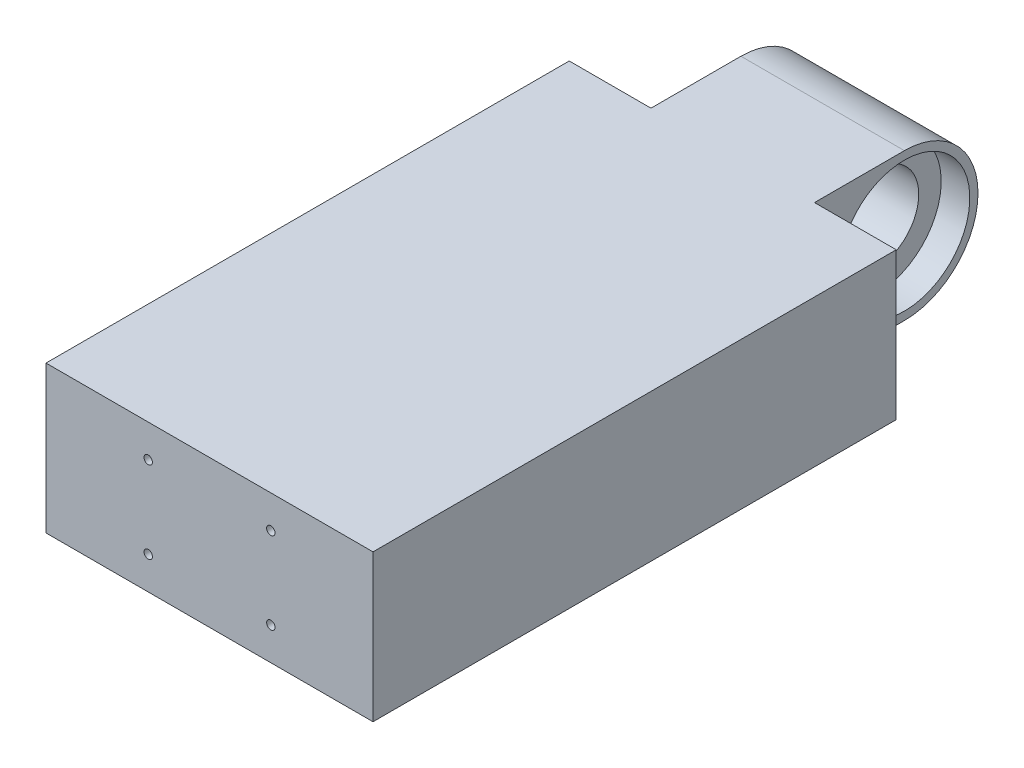
from build123d import *

# Parameters (mm, degrees)
SKETCH1_W               = 80
SKETCH1_H               = 36
BOSS_EXTRUDE1_DEPTH     = 150
M2_5_TAPPED_HOLE1_D     = 2.05
M2_5_TAPPED_HOLE1_DEPTH = 3.35
M2_5_TAPPED_HOLE1_TIP   = 0.615882135
BOSS_EXTRUDE2_DEPTH     = 80
SKETCH7_W               = 20
SKETCH7_H               = 40
CUT_EXTRUDE4_DEPTH      = 80
SKETCH5_R               = 10.5
CUT_EXTRUDE5_DEPTH      = 80
SKETCH8_R               = 16
CUT_EXTRUDE6_DEPTH      = 7


with BuildPart() as part:
    # Sketch1 → Boss-Extrude1 (new body)
    with BuildSketch(Plane.XY):
        with Locations((40, 18)):
            Rectangle(SKETCH1_W, SKETCH1_H)
    extrude(amount=BOSS_EXTRUDE1_DEPTH)

    # M2.5 Tapped Hole1
    with Locations(Plane(origin=(25, 28, 150), x_dir=(1, 0, 0), z_dir=(0, 0, 1))):
        with Locations((0, 0), (30, 0), (30, -20), (0, -20)):
            Hole(M2_5_TAPPED_HOLE1_D / 2, depth=M2_5_TAPPED_HOLE1_DEPTH)
            with Locations((0, 0, -(M2_5_TAPPED_HOLE1_DEPTH + M2_5_TAPPED_HOLE1_TIP / 2))):  # 118° drill point
                Cone(0, M2_5_TAPPED_HOLE1_D / 2, M2_5_TAPPED_HOLE1_TIP, mode=Mode.SUBTRACT)

    # Sketch4 → Boss-Extrude2 (add)
    with BuildSketch(Plane.ZY):
        with BuildLine():
            Line((0, 36), (0, 0))
            ThreePointArc((0, 0), (-18, 18), (0, 36))
        make_face()
    extrude(amount=-BOSS_EXTRUDE2_DEPTH)

    # Sketch7 → Cut-Extrude4 (cut)
    with BuildSketch(Plane(origin=(0, 36, 0), x_dir=(1, 0, 0), z_dir=(0, 1, 0))):
        with Locations((10, -2)):
            Rectangle(SKETCH7_W, SKETCH7_H)
        with Locations((70, -2)):
            Rectangle(SKETCH7_W, SKETCH7_H)
    extrude(amount=-CUT_EXTRUDE4_DEPTH, mode=Mode.SUBTRACT)

    # Sketch5 → Cut-Extrude5 (cut)
    with BuildSketch(Plane.ZY):
        with Locations((0, 18)):
            Circle(SKETCH5_R)
    extrude(amount=-CUT_EXTRUDE5_DEPTH, mode=Mode.SUBTRACT)

    # Sketch8 → Cut-Extrude6 (cut)
    with BuildSketch(Plane.ZY.offset(-20)):
        with Locations((0, 18)):
            Circle(SKETCH8_R)
    cut_extrude6 = extrude(amount=-CUT_EXTRUDE6_DEPTH, mode=Mode.SUBTRACT)

    # Mirror1: Cut-Extrude6 across plane
    add(cut_extrude6.mirror(Plane.ZY.offset(-40)), mode=Mode.SUBTRACT)


solid = part.part
